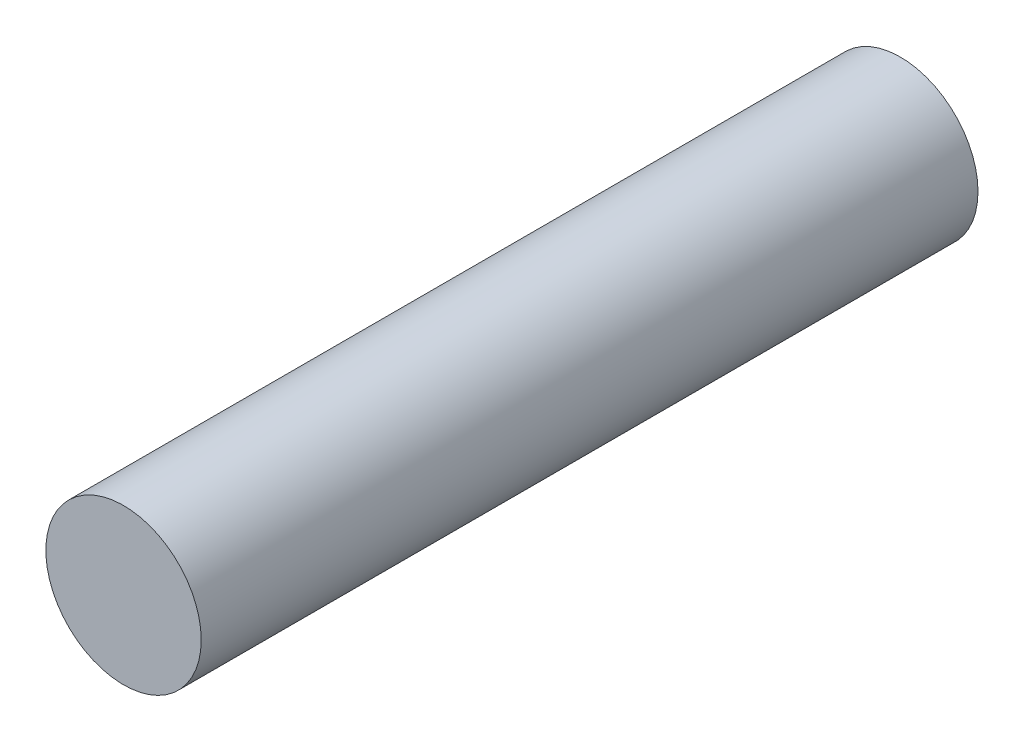
from build123d import *

# Parameters (mm, degrees)
SKETCH_1_R      = 6
EXTRUDE_1_DEPTH = 60


with BuildPart() as part:
    # 草图1 → 凸台-拉伸1 (new body)
    with BuildSketch(Plane.XY):
        Circle(SKETCH_1_R)
    extrude(amount=EXTRUDE_1_DEPTH)


solid = part.part
